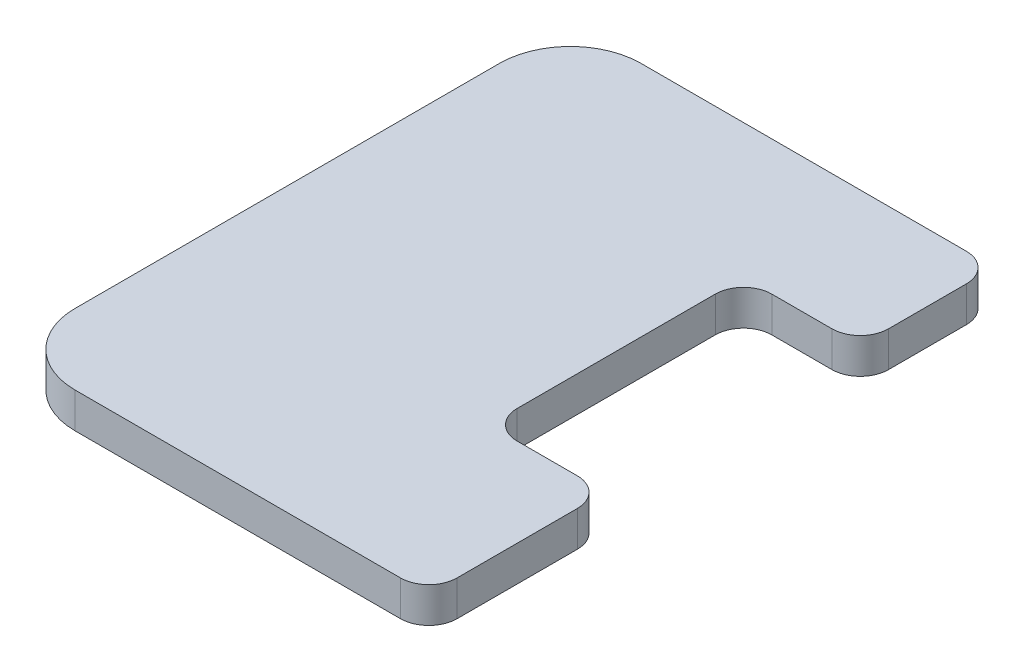
from build123d import *

# Parameters (mm, degrees)
SKETCH1_W           = 38.1
SKETCH1_H           = 50.8
BOSS_EXTRUDE1_DEPTH = 3.175
SKETCH2_W           = 10.4775
SKETCH2_H           = 22.86
CUT_EXTRUDE2_DEPTH  = 32.908355097
FILLET1_R           = 2.54
FILLET2_R           = 6.35


with BuildPart() as part:
    # Sketch1 → Boss-Extrude1 (new body)
    with BuildSketch(Plane(origin=(0, 0, 0), x_dir=(1, 0, 0), z_dir=(0, 1, 0))):
        Rectangle(SKETCH1_W, SKETCH1_H)
    extrude(amount=BOSS_EXTRUDE1_DEPTH)

    # Sketch2 → Cut-Extrude2 (cut, through all)
    with BuildSketch(Plane(origin=(0, 3.175, 0), x_dir=(1, 0, 0), z_dir=(0, 1, 0))):
        with Locations((13.81125, 1.905)):
            Rectangle(SKETCH2_W, SKETCH2_H)
    extrude(amount=-CUT_EXTRUDE2_DEPTH, mode=Mode.SUBTRACT)

    # Fillet1
    fillet1_edges = [part.edges().sort_by_distance(p)[0] for p in [
        (19.05, 1.5875, -13.335),
        (19.05, 1.5875, 9.525),
        (8.5725, 1.5875, 9.525),
        (8.5725, 1.5875, -13.335),
        (19.05, 1.5875, 25.4),
        (19.05, 1.5875, -25.4),
    ]]
    fillet(fillet1_edges, radius=FILLET1_R)

    # Fillet2
    fillet2_edges = [part.edges().sort_by_distance(p)[0] for p in [
        (-19.05, 1.5875, 25.4),
        (-19.05, 1.5875, -25.4),
    ]]
    fillet(fillet2_edges, radius=FILLET2_R)


solid = part.part
